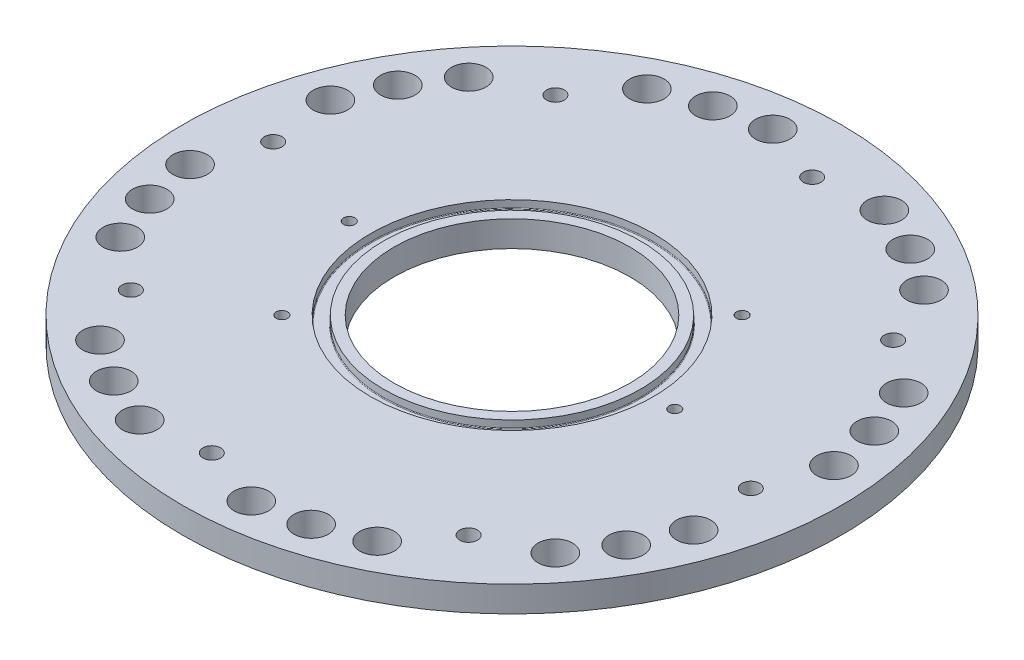
from build123d import *

# Parameters (mm, degrees)
SKETCH1_R                            = 121.5
SKETCH1_R_2                          = 43.5
BOSS_EXTRUDE1_DEPTH                  = 9.525
CUT_EXTRUDE1_START                   = 9.525
SKETCH1_4_R                          = 52.1208
SKETCH1_4_R_2                        = 47.371
CUT_EXTRUDE1_DEPTH                   = 2.8448
CIRPATTERN1_COUNT                    = 16
SKETCH5_R                            = 6.35
CUBE_5_16_CLEARANCE_THRU_HOLES_DEPTH = 173.090748226
F_5_16_18_TAPPED_HOLE1_D             = 6.5278
CIRPATTERN3_COUNT                    = 8
BOTTOM_ISO160_R                      = 76.5
BOTTOM_ISO160_R_2                    = 70.1548
CUT_EXTRUDE3_DEPTH                   = 2.79
FILLET1_R                            = 0.254


with BuildPart() as part:
    # Sketch1 → Boss-Extrude1 (new body)
    with BuildSketch(Plane(origin=(0, 0, 0), x_dir=(1, 0, 0), z_dir=(0, 1, 0))):
        with Locations(Location((0, 0, 0), (0, 0, 90))):
            Circle(SKETCH1_R)
        with Locations(Location((0, 0, 0), (0, 0, 90))):
            Circle(SKETCH1_R_2, mode=Mode.SUBTRACT)
    extrude(amount=BOSS_EXTRUDE1_DEPTH)

    # Sketch1<4> → Cut-Extrude1 (cut)
    with BuildSketch(Plane(origin=(0, 0, 0), x_dir=(1, 0, 0), z_dir=(0, 1, 0)).offset(CUT_EXTRUDE1_START)):
        with Locations(Location((0, 0, 0), (0, 0, 270))):
            Circle(SKETCH1_4_R)
        with Locations(Location((0, 0, 0), (0, 0, 270))):
            Circle(SKETCH1_4_R_2, mode=Mode.SUBTRACT)
    extrude(amount=-CUT_EXTRUDE1_DEPTH, mode=Mode.SUBTRACT)

    # Sketch4 → M5x0.8 Tapped Hole2 (revolve, cut)
    with BuildSketch(Plane(origin=(60, 9.525, 0), x_dir=(0, 0, 1), z_dir=(1, 0, 0))):
        Polygon((0, 0), (0, 7), (2.1, 5.7381927), (2.1, 0), align=None)
    m5x0_8_tapped_hole2 = revolve(axis=Axis((60, 15.875, 0), (0, -1, 0)), mode=Mode.SUBTRACT)

    # CirPattern1: M5x0.8 Tapped Hole2 ×16 about axis, 12 skipped
    cirpattern1_axis = Axis((0, 9.525, 0), (0, -1, 0))
    add([m5x0_8_tapped_hole2.rotate(cirpattern1_axis, i * 360 / CIRPATTERN1_COUNT) for i in range(1, CIRPATTERN1_COUNT) if i not in (1, 2, 3, 4, 5, 7, 9, 10, 11, 12, 13, 15)], mode=Mode.SUBTRACT)

    # Sketch5 → Cube_5/16_Clearance_Thru Holes (cut, through all)
    with BuildSketch(Plane(origin=(0, 0, 0), x_dir=(1, 0, 0), z_dir=(0, 1, 0))):
        with Locations(Location((103.816263161, 29.768834428, 0), (0, 0, 270))):
            Circle(SKETCH5_R)
        with Locations(Location((94.458928371, -52.359438987, 0), (0, 0, 270))):
            Circle(SKETCH5_R)
        with Locations(Location((29.768834428, -103.816263161, 0), (0, 0, 270))):
            Circle(SKETCH5_R)
        with Locations(Location((-52.359438987, -94.458928371, 0), (0, 0, 270))):
            Circle(SKETCH5_R)
        with Locations(Location((-103.816263161, -29.768834428, 0), (0, 0, 270))):
            Circle(SKETCH5_R)
        with Locations(Location((-94.458928371, 52.359438987, 0), (0, 0, 270))):
            Circle(SKETCH5_R)
        with Locations(Location((52.359438987, 94.458928371, 0), (0, 0, 270))):
            Circle(SKETCH5_R)
        with Locations(Location((-29.768834428, 103.816263161, 0), (0, 0, 270))):
            Circle(SKETCH5_R)
        with Locations(Location((11.289074033, -107.4083647, 0), (0, 0, 270))):
            Circle(SKETCH5_R)
        with Locations(Location((47.344083853, -97.069757, 0), (0, 0, 270))):
            Circle(SKETCH5_R)
        with Locations(Location((83.931763837, -67.966602233, 0), (0, 0, 270))):
            Circle(SKETCH5_R)
        with Locations(Location((102.116006165, -35.161360681, 0), (0, 0, 270))):
            Circle(SKETCH5_R)
        with Locations(Location((107.4083647, 11.289074033, 0), (0, 0, 270))):
            Circle(SKETCH5_R)
        with Locations(Location((97.069757, 47.344083853, 0), (0, 0, 270))):
            Circle(SKETCH5_R)
        with Locations(Location((-35.161360681, -102.116006165, 0), (0, 0, 270))):
            Circle(SKETCH5_R)
        with Locations(Location((-67.966602233, -83.931763837, 0), (0, 0, 270))):
            Circle(SKETCH5_R)
        with Locations(Location((-107.4083647, -11.289074033, 0), (0, 0, 270))):
            Circle(SKETCH5_R)
        with Locations(Location((-97.069757, -47.344083853, 0), (0, 0, 270))):
            Circle(SKETCH5_R)
        with Locations(Location((-102.116006165, 35.161360681, 0), (0, 0, 270))):
            Circle(SKETCH5_R)
        with Locations(Location((-83.931763837, 67.966602233, 0), (0, 0, 270))):
            Circle(SKETCH5_R)
        with Locations(Location((35.161360681, 102.116006165, 0), (0, 0, 270))):
            Circle(SKETCH5_R)
        with Locations(Location((67.966602233, 83.931763837, 0), (0, 0, 270))):
            Circle(SKETCH5_R)
        with Locations(Location((-11.289074033, 107.4083647, 0), (0, 0, 270))):
            Circle(SKETCH5_R)
        with Locations(Location((-47.344083853, 97.069757, 0), (0, 0, 270))):
            Circle(SKETCH5_R)
    extrude(amount=CUBE_5_16_CLEARANCE_THRU_HOLES_DEPTH, mode=Mode.SUBTRACT)

    # 5/16-18 Tapped Hole1 (through all)
    with Locations(Plane(origin=(-62.251463664, 0, -78.260815685), x_dir=(0, 0, -1), z_dir=(0, -1, 0))):
        with Locations((0, 0)):
            f_5_16_18_tapped_hole1 = Hole(F_5_16_18_TAPPED_HOLE1_D / 2)

    # CirPattern3: 5/16-18 Tapped Hole1 ×8 about axis
    cirpattern3_axis = Axis((0, 0, 0), (0, 1, 0))
    for i in range(1, CIRPATTERN3_COUNT):
        add(f_5_16_18_tapped_hole1.rotate(cirpattern3_axis, i * 360 / CIRPATTERN3_COUNT), mode=Mode.SUBTRACT)

    # Bottom_Iso160 → Cut-Extrude3 (cut)
    with BuildSketch(Plane(origin=(0, 0, 0), x_dir=(1, 0, 0), z_dir=(0, 1, 0))):
        with Locations(Location((0, 0, 0), (0, 0, 270))):
            Circle(BOTTOM_ISO160_R)
        with Locations(Location((0, 0, 0), (0, 0, 270))):
            Circle(BOTTOM_ISO160_R_2, mode=Mode.SUBTRACT)
    extrude(amount=CUT_EXTRUDE3_DEPTH, mode=Mode.SUBTRACT)

    # Fillet1
    fillet1_edges = [part.edges().sort_by_distance(p)[0] for p in [
        (0, 6.6802, -52.1208),
        (0, 6.6802, -47.371),
    ]]
    fillet(fillet1_edges, radius=FILLET1_R)


solid = part.part
